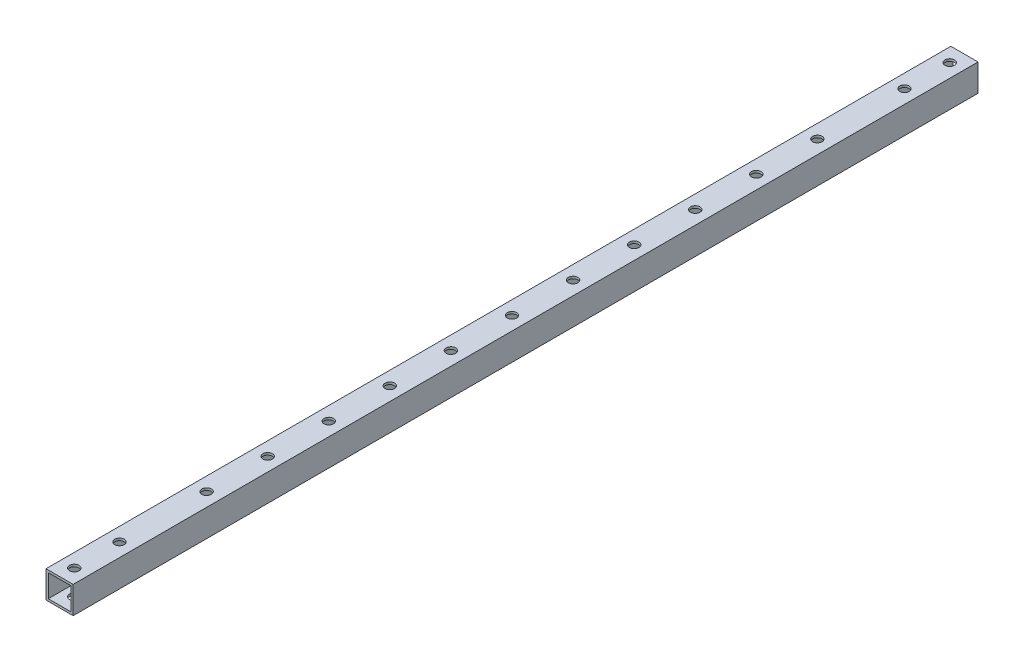
from build123d import *

# Parameters (mm, degrees)
SKETCH_1_W          = 12
SKETCH_1_H          = 12
SKETCH_1_W_2        = 10
SKETCH_1_H_2        = 10
EXTRUDE_1_DEPTH     = 400
SKETCH_2_R          = 2.1
CUT_EXTRUDE_1_DEPTH = 500
SKETCH_3_R          = 2.1
CUT_EXTRUDE_2_DEPTH = 102


with BuildPart() as part:
    # 草图1 → 凸台-拉伸1 (new body)
    with BuildSketch(Plane.XY):
        Rectangle(SKETCH_1_W, SKETCH_1_H)
        Rectangle(SKETCH_1_W_2, SKETCH_1_H_2, mode=Mode.SUBTRACT)
    extrude(amount=EXTRUDE_1_DEPTH)

    # 草图2 → 切除-拉伸1 (cut)
    with BuildSketch(Plane(origin=(0, 6, 0), x_dir=(1, 0, 0), z_dir=(0, 1, 0))):
        with Locations(Location((0, -200, 0), (0, 0, 180))):
            Circle(SKETCH_2_R)
        with Locations(Location((0, -227, 0), (0, 0, 180))):
            Circle(SKETCH_2_R)
        with Locations(Location((0, -254, 0), (0, 0, 180))):
            Circle(SKETCH_2_R)
        with Locations(Location((0, -281, 0), (0, 0, 180))):
            Circle(SKETCH_2_R)
        with Locations(Location((0, -308, 0), (0, 0, 180))):
            Circle(SKETCH_2_R)
        with Locations(Location((0, -335, 0), (0, 0, 180))):
            Circle(SKETCH_2_R)
        with Locations(Location((0, -173, 0), (0, 0, 180))):
            Circle(SKETCH_2_R)
        with Locations(Location((0, -146, 0), (0, 0, 180))):
            Circle(SKETCH_2_R)
        with Locations(Location((0, -119, 0), (0, 0, 180))):
            Circle(SKETCH_2_R)
        with Locations(Location((0, -92, 0), (0, 0, 180))):
            Circle(SKETCH_2_R)
        with Locations(Location((0, -65, 0), (0, 0, 180))):
            Circle(SKETCH_2_R)
    extrude(amount=-CUT_EXTRUDE_1_DEPTH, mode=Mode.SUBTRACT)

    # 草图3 → 切除-拉伸2 (cut)
    with BuildSketch(Plane(origin=(0, 6, 0), x_dir=(1, 0, 0), z_dir=(0, 1, 0))):
        with Locations(Location((0, -6.5, 0), (0, 0, 180))):
            Circle(SKETCH_3_R)
        with Locations(Location((0, -26.5, 0), (0, 0, 180))):
            Circle(SKETCH_3_R)
        with Locations(Location((0, -373.5, 0), (0, 0, 180))):
            Circle(SKETCH_3_R)
        with Locations(Location((0, -393.5, 0), (0, 0, 180))):
            Circle(SKETCH_3_R)
    extrude(amount=-CUT_EXTRUDE_2_DEPTH, mode=Mode.SUBTRACT)


solid = part.part
